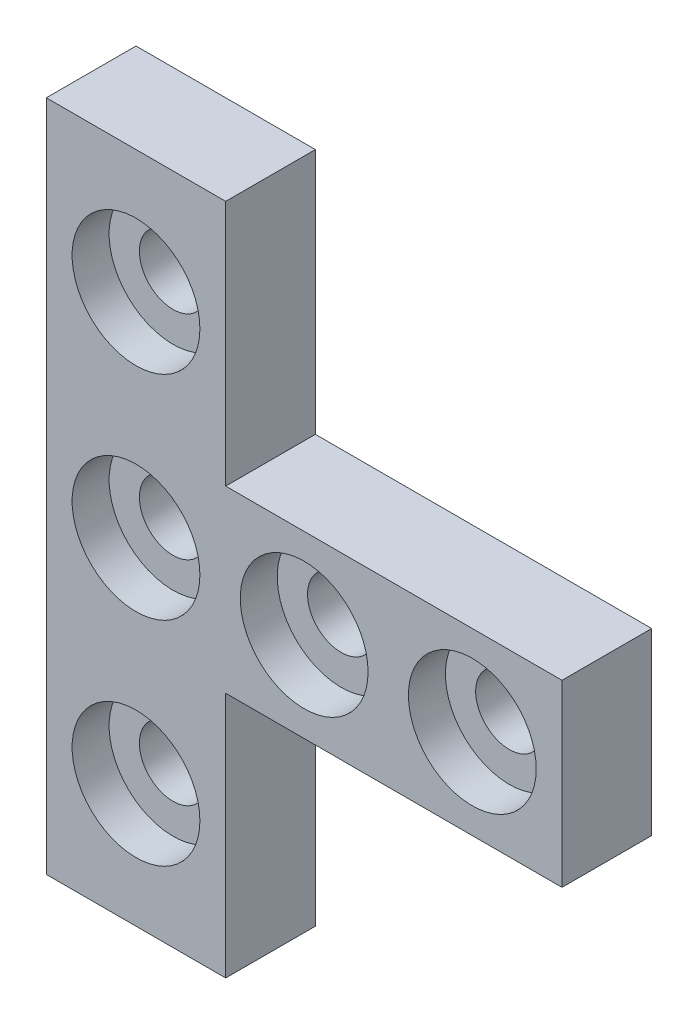
from build123d import *

# Parameters (mm, degrees)
CROQUIS2_R              = 1.5
SALIENTE_EXTRUIR1_DEPTH = 4
CROQUIS3_R              = 2.85
CORTAR_EXTRUIR1_DEPTH   = 1.65


with BuildPart() as part:
    # Croquis2 → Saliente-Extruir1 (new body)
    with BuildSketch(Plane.XY):
        Polygon((38.497217209, -204.70543153), (46.497217209, -204.70543153), (46.497217209, -193.70543153), (61.497217209, -193.70543153), (61.497217209, -185.70543153), (46.497217209, -185.70543153), (46.497217209, -174.70543153), (38.497217209, -174.70543153), align=None)
        with Locations((42.497217209, -189.70543153)):
            Circle(CROQUIS2_R, mode=Mode.SUBTRACT)
        with Locations((42.497217209, -199.20543153)):
            Circle(CROQUIS2_R, mode=Mode.SUBTRACT)
        with Locations((57.497217209, -189.70543153)):
            Circle(CROQUIS2_R, mode=Mode.SUBTRACT)
        with Locations((49.997217209, -189.70543153)):
            Circle(CROQUIS2_R, mode=Mode.SUBTRACT)
        with Locations((42.497217209, -180.20543153)):
            Circle(CROQUIS2_R, mode=Mode.SUBTRACT)
    extrude(amount=SALIENTE_EXTRUIR1_DEPTH)

    # Croquis3 → Cortar-Extruir1 (cut)
    with BuildSketch(Plane.XY.offset(4)):
        with Locations((42.497217209, -199.20543153)):
            Circle(CROQUIS3_R)
        with Locations((42.497217209, -189.70543153)):
            Circle(CROQUIS3_R)
        with Locations((42.497217209, -180.20543153)):
            Circle(CROQUIS3_R)
        with Locations((49.997217209, -189.70543153)):
            Circle(CROQUIS3_R)
        with Locations((57.497217209, -189.70543153)):
            Circle(CROQUIS3_R)
    extrude(amount=-CORTAR_EXTRUIR1_DEPTH, mode=Mode.SUBTRACT)


solid = part.part
